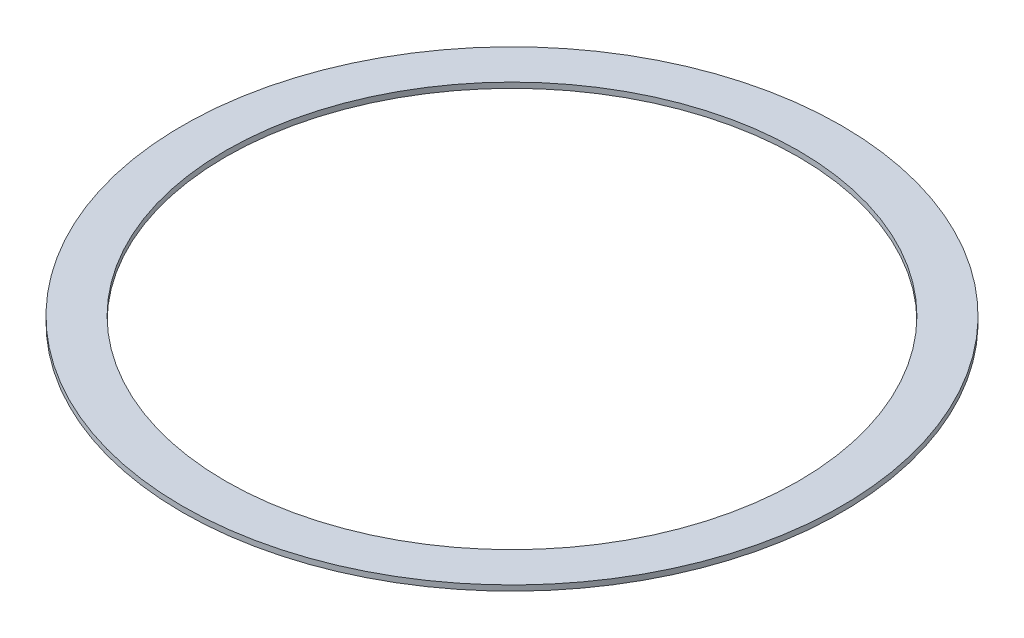
from build123d import *

# Parameters (mm, degrees)
SKETCH_1_R      = 30.5
SKETCH_1_R_2    = 26.5
EXTRUDE_1_DEPTH = 0.5


with BuildPart() as part:
    # 草图1 → 凸台-拉伸1 (new body)
    with BuildSketch(Plane(origin=(0, 0, 0), x_dir=(1, 0, 0), z_dir=(0, 1, 0))):
        with Locations(Location((0, 0, 0), (0, 0, 270))):
            Circle(SKETCH_1_R)
        with Locations(Location((0, 0, 0), (0, 0, 270))):
            Circle(SKETCH_1_R_2, mode=Mode.SUBTRACT)
    extrude(amount=EXTRUDE_1_DEPTH)


solid = part.part
